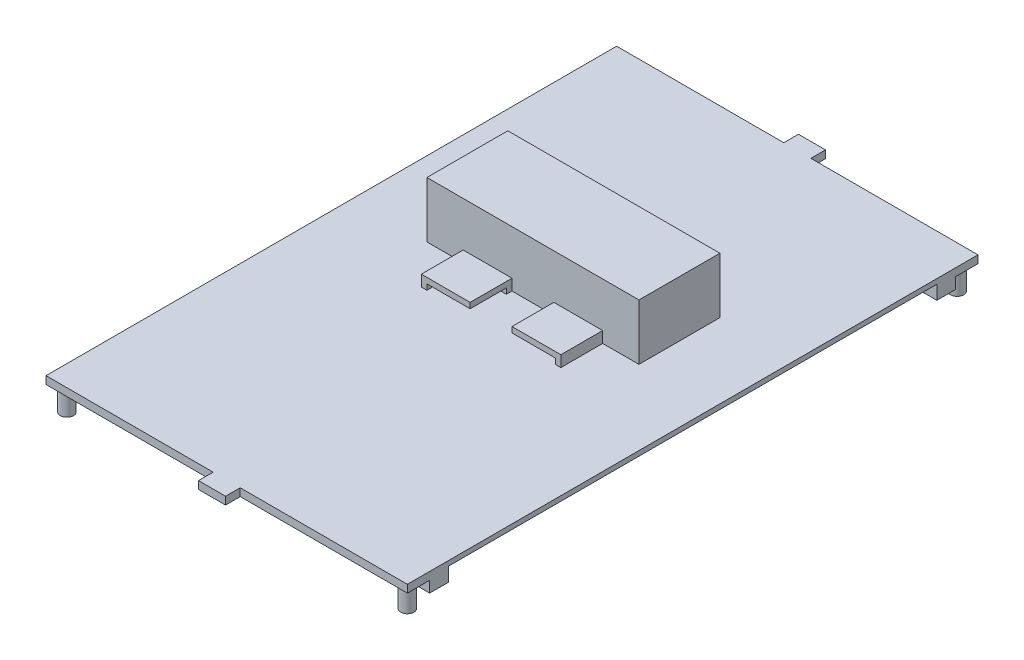
from build123d import *

# Parameters (mm, degrees)
SKETCH_1_W          = 129.5
SKETCH_1_H          = 204.5
EXTRUDE_1_DEPTH     = 6.75
SKETCH_2_W          = 129.5
SKETCH_2_H          = 8
CUT_EXTRUDE_1_DEPTH = 4
SKETCH_3_R          = 2.35
EXTRUDE_2_DEPTH     = 8.5
SKETCH_4_W          = 120
SKETCH_4_H          = 175
CUT_EXTRUDE_3_DEPTH = 5
SKETCH_5_W          = 9.7
SKETCH_5_H          = 215
EXTRUDE_3_DEPTH     = 2.75
SKETCH_6_W          = 50
SKETCH_6_H          = 15
EXTRUDE_4_DEPTH     = 4
SKETCH_7_W          = 46
SKETCH_7_H          = 2
CUT_EXTRUDE_4_DEPTH = 13
SKETCH_8_W          = 15
SKETCH_8_H          = 15
CUT_EXTRUDE_5_DEPTH = 4
SKETCH_9_W          = 76
SKETCH_9_H          = 29
EXTRUDE_5_DEPTH     = 20
SKETCH_10_W         = 9.7
SKETCH_10_H         = 175
CUT_EXTRUDE_6_DEPTH = 1
SKETCH_11_W         = 71
SKETCH_11_H         = 25.5
CUT_EXTRUDE_8_DEPTH = 20.2


with BuildPart() as part:
    # 草图1 → 凸台-拉伸1 (new body)
    with BuildSketch(Plane(origin=(0, 0, 0), x_dir=(1, 0, 0), z_dir=(0, 1, 0))):
        Rectangle(SKETCH_1_W, SKETCH_1_H)
    extrude(amount=EXTRUDE_1_DEPTH)

    # 草图2 → 切除-拉伸1 (cut)
    with BuildSketch(Plane.XZ):
        with Locations((0, 98.25)):
            Rectangle(SKETCH_2_W, SKETCH_2_H)
        with Locations((0, -98.25)):
            Rectangle(SKETCH_2_W, SKETCH_2_H)
    extrude(amount=-CUT_EXTRUDE_1_DEPTH, mode=Mode.SUBTRACT)

    # 草图3 → 凸台-拉伸2 (add)
    with BuildSketch(Plane.XZ.offset(-4)):
        with Locations(Location((-61, 98.5, 0), (0, 0, 270))):
            Circle(SKETCH_3_R)
        with Locations(Location((61, 98.5, 0), (0, 0, 270))):
            Circle(SKETCH_3_R)
        with Locations(Location((61, -98.5, 0), (0, 0, 90))):
            Circle(SKETCH_3_R)
        with Locations(Location((-61, -98.5, 0), (0, 0, 90))):
            Circle(SKETCH_3_R)
    extrude(amount=EXTRUDE_2_DEPTH)

    # 草图4 → 切除-拉伸3 (cut)
    with BuildSketch(Plane.XZ):
        with Locations((4.75, 0)):
            Rectangle(SKETCH_4_W, SKETCH_4_H)
    extrude(amount=-CUT_EXTRUDE_3_DEPTH, mode=Mode.SUBTRACT)

    # 草图5 → 凸台-拉伸3 (add)
    with BuildSketch(Plane(origin=(0, 6.75, 0), x_dir=(1, 0, 0), z_dir=(0, 1, 0))):
        Rectangle(SKETCH_5_W, SKETCH_5_H)
    extrude(amount=-EXTRUDE_3_DEPTH)

    # 草图6 → 凸台-拉伸4 (add)
    with BuildSketch(Plane(origin=(0, 6.75, 0), x_dir=(1, 0, 0), z_dir=(0, 1, 0))):
        Rectangle(SKETCH_6_W, SKETCH_6_H)
    extrude(amount=EXTRUDE_4_DEPTH)

    # 草图7 → 切除-拉伸4 (cut)
    with BuildSketch(Plane.XY.offset(7.5)):
        with Locations((0, 7.75)):
            Rectangle(SKETCH_7_W, SKETCH_7_H)
    extrude(amount=-CUT_EXTRUDE_4_DEPTH, mode=Mode.SUBTRACT)

    # 草图8 → 切除-拉伸5 (cut)
    with BuildSketch(Plane(origin=(0, 10.75, 0), x_dir=(1, 0, 0), z_dir=(0, 1, 0))):
        Rectangle(SKETCH_8_W, SKETCH_8_H)
    extrude(amount=-CUT_EXTRUDE_5_DEPTH, mode=Mode.SUBTRACT)

    # 草图9 → 凸台-拉伸5 (add)
    with BuildSketch(Plane(origin=(0, 6.75, 0), x_dir=(1, 0, 0), z_dir=(0, 1, 0))):
        with Locations((0, 22)):
            Rectangle(SKETCH_9_W, SKETCH_9_H)
    extrude(amount=EXTRUDE_5_DEPTH)

    # 草图10 → 切除-拉伸6 (cut)
    with BuildSketch(Plane.XZ.offset(-4)):
        Rectangle(SKETCH_10_W, SKETCH_10_H)
    extrude(amount=-CUT_EXTRUDE_6_DEPTH, mode=Mode.SUBTRACT)

    # 草图11 → 切除-拉伸8 (cut)
    with BuildSketch(Plane.XZ.offset(-5)):
        with Locations((0, -22)):
            Rectangle(SKETCH_11_W, SKETCH_11_H)
    extrude(amount=-CUT_EXTRUDE_8_DEPTH, mode=Mode.SUBTRACT)


solid = part.part
